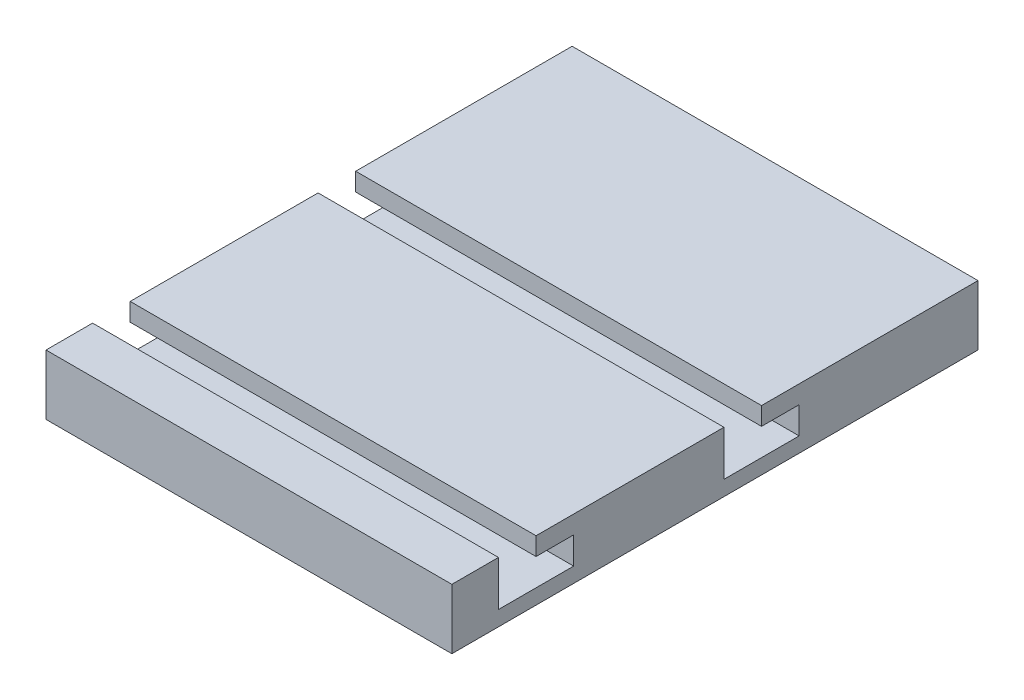
from build123d import *

# Parameters (mm, degrees)
SKETCH1_W           = 68.58
SKETCH1_H           = 88.9
BOSS_EXTRUDE1_DEPTH = 2.54
SKETCH2_W           = 68.58
SKETCH2_H           = 5.08
BOSS_EXTRUDE2_DEPTH = 7.62
SKETCH3_W           = 68.58
SKETCH3_H           = 3.048
BOSS_EXTRUDE3_DEPTH = 6.35
SKETCH4_W           = 68.58
SKETCH4_H           = 3.048
BOSS_EXTRUDE4_DEPTH = 6.35
SKETCH5_W           = 68.58
SKETCH5_H           = 26.416
SKETCH5_H_2         = 21.59
SKETCH5_H_3         = 7.874
BOSS_EXTRUDE5_DEPTH = 7.62
SKETCH6_W           = 4.572
SKETCH6_H           = 1.27
SKETCH6_W_2         = 3.048
CUT_EXTRUDE1_DEPTH  = 113.737092388


with BuildPart() as part:
    # Sketch1 → Boss-Extrude1 (new body)
    with BuildSketch(Plane(origin=(0, 0, 0), x_dir=(-1, 0, 0), z_dir=(0, 1, 0))):
        with Locations((34.29, 44.45)):
            Rectangle(SKETCH1_W, SKETCH1_H)
    extrude(amount=BOSS_EXTRUDE1_DEPTH)

    # Sketch2 → Boss-Extrude2 (add)
    with BuildSketch(Plane(origin=(0, 2.54, 0), x_dir=(-1, 0, 0), z_dir=(0, 1, 0))):
        with Locations((34.29, 67.056)):
            Rectangle(SKETCH2_W, SKETCH2_H)
        with Locations((34.29, 28.956)):
            Rectangle(SKETCH2_W, SKETCH2_H)
    extrude(amount=BOSS_EXTRUDE2_DEPTH)

    # Sketch3 → Boss-Extrude3 (add)
    with BuildSketch(Plane.XY.offset(31.496)):
        with Locations((-34.29, 8.636)):
            Rectangle(SKETCH3_W, SKETCH3_H)
    extrude(amount=BOSS_EXTRUDE3_DEPTH)

    # Sketch4 → Boss-Extrude4 (add)
    with BuildSketch(Plane.XY.offset(69.596)):
        with Locations((-34.29, 8.636)):
            Rectangle(SKETCH4_W, SKETCH4_H)
    extrude(amount=BOSS_EXTRUDE4_DEPTH)

    # Sketch5 → Boss-Extrude5 (add)
    with BuildSketch(Plane(origin=(0, 2.54, 0), x_dir=(-1, 0, 0), z_dir=(0, 1, 0))):
        with Locations((34.29, 13.208)):
            Rectangle(SKETCH5_W, SKETCH5_H)
        with Locations((34.29, 53.721)):
            Rectangle(SKETCH5_W, SKETCH5_H_2)
        with Locations((34.29, 84.963)):
            Rectangle(SKETCH5_W, SKETCH5_H_3)
    extrude(amount=BOSS_EXTRUDE5_DEPTH)

    # Sketch6 → Cut-Extrude1 (cut, through all)
    with BuildSketch(Plane.YZ):
        with Locations((4.826, 68.961)):
            Rectangle(SKETCH6_W, SKETCH6_H)
        with Locations((4.826, 30.861)):
            Rectangle(SKETCH6_W, SKETCH6_H)
        with Locations((8.636, 37.211)):
            Rectangle(SKETCH6_W_2, SKETCH6_H)
        with Locations((8.636, 75.311)):
            Rectangle(SKETCH6_W_2, SKETCH6_H)
    extrude(amount=-CUT_EXTRUDE1_DEPTH, mode=Mode.SUBTRACT)


solid = part.part
